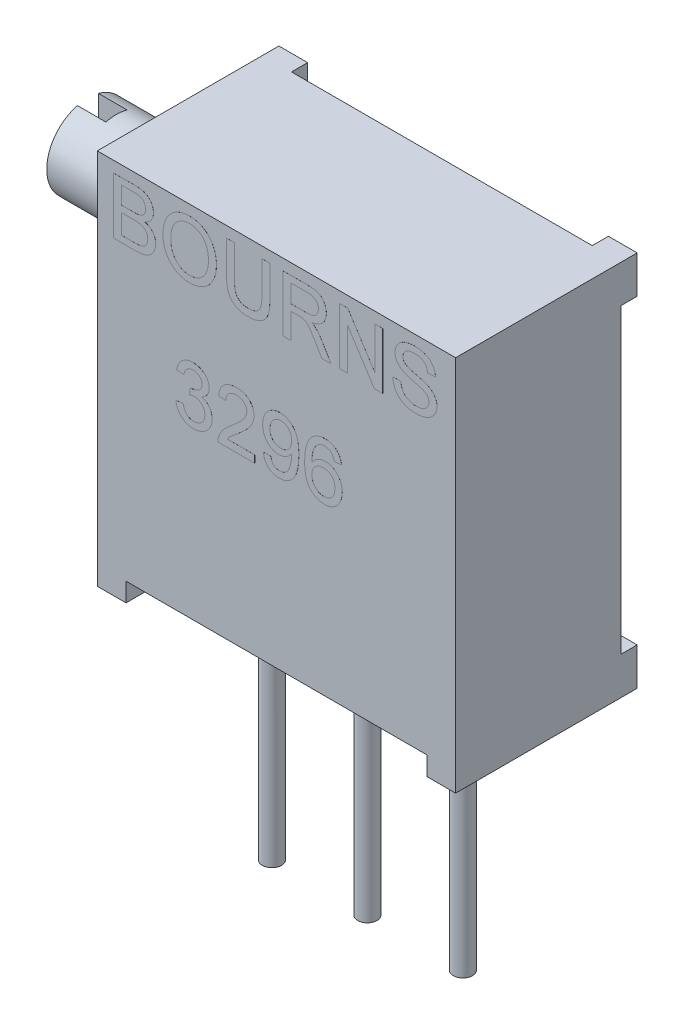
from build123d import *

# Parameters (mm, degrees)
SKETCH1_W          = 9.53
SKETCH1_H          = 10.03
EXTRUDE1_DEPTH     = 4.4
SKETCH2_W          = 8
SKETCH2_H          = 0.5
CUT_EXTRUDE1_DEPTH = 12.94429257
SKETCH3_W          = 0.765
SKETCH3_H          = 1
EXTRUDE2_DEPTH     = 0.43
SKETCH4_R          = 0.255
EXTRUDE3_DEPTH     = 6.9
EXTRUDE5_DEPTH     = 0.001
SKETCH_1_R         = 1.095
EXTRUDE8_DEPTH     = 1.52
SKETCH_2_W         = 0.56
SKETCH_2_H         = 4.322685763
CUT_EXTRUDE3_DEPTH = 0.76


with BuildPart() as part:
    # Sketch1 → Extrude1 (new body)
    with BuildSketch(Plane.XY):
        with Locations((0, 5.015)):
            Rectangle(SKETCH1_W, SKETCH1_H)
    extrude(amount=EXTRUDE1_DEPTH)

    # Sketch2 → Cut-Extrude1 (cut, through all)
    with BuildSketch(Plane.XY.offset(4.4)):
        with Locations((0, 0.25)):
            Rectangle(SKETCH2_W, SKETCH2_H)
    extrude(amount=-CUT_EXTRUDE1_DEPTH, mode=Mode.SUBTRACT)

    # Sketch3 → Extrude2 (add)
    with BuildSketch(Plane(origin=(0, 0, 0), x_dir=(-1, 0, 0), z_dir=(0, 0, -1))):
        with Locations((-4.3825, 0.5)):
            Rectangle(SKETCH3_W, SKETCH3_H)
        with Locations((4.3825, 0.5)):
            Rectangle(SKETCH3_W, SKETCH3_H)
        with Locations((4.3825, 9.53)):
            Rectangle(SKETCH3_W, SKETCH3_H)
        with Locations((-4.3825, 9.53)):
            Rectangle(SKETCH3_W, SKETCH3_H)
    extrude(amount=EXTRUDE2_DEPTH)

    # Sketch4 → Extrude3 (add)
    with BuildSketch(Plane.XZ.offset(-0.5)):
        with Locations(Location((2.54, 1.98, 0), (0, 0, 90))):
            Circle(SKETCH4_R)
        with Locations(Location((0, 1.98, 0), (0, 0, 90))):
            Circle(SKETCH4_R)
        with Locations(Location((-2.54, 1.98, 0), (0, 0, 90))):
            Circle(SKETCH4_R)
    extrude(amount=EXTRUDE3_DEPTH)

    # Sketch7 → Extrude5 (add)
    # profile 1 of 10: a face of its own
    with BuildSketch(Plane.XY.offset(4.4)):
        with BuildLine():
            Line((-4.326444342, 8.237150921), (-4.326444342, 9.737150921))
            Line((-4.326444342, 9.737150921), (-3.764845784, 9.737150921))
            add(Edge.make_bspline(
                [(-3.764845784, 9.737150921), (-3.750919069, 9.737097495), (-3.723744088, 9.736993245), (-3.684062996, 9.734386066), (-3.64648204, 9.730819986), (-3.610920315, 9.726223199), (-3.577531697, 9.719553354), (-3.5463473, 9.711473284), (-3.517204841, 9.702153183), (-3.481582627, 9.687955652), (-3.44053193, 9.666102632), (-3.396562734, 9.63349448), (-3.358307825, 9.594343785), (-3.326829661, 9.549455296), (-3.300895048, 9.501505925), (-3.282507712, 9.451409151), (-3.270751692, 9.400255705), (-3.269417834, 9.365618225), (-3.268752034, 9.348328806)],
                knots=[0, 0, 0, 0, 0.939712594, 1.833646414, 2.682508961, 3.487467313, 4.25240329, 4.978730417, 5.660668875, 6.315918528, 7.564895217, 8.787077865, 9.996481721, 11.241996224, 12.475862915, 13.665015424, 14.834484263, 16, 16, 16, 16], degree=3))
            add(Edge.make_bspline(
                [(-3.268752034, 9.348328806), (-3.26945193, 9.332243346), (-3.270844975, 9.300227505), (-3.281932051, 9.253066225), (-3.29943085, 9.207272915), (-3.324174647, 9.163404285), (-3.35580032, 9.122262901), (-3.395007125, 9.085240754), (-3.441231661, 9.052258501), (-3.475923175, 9.03467799), (-3.49381213, 9.025612459)],
                knots=[0, 0, 0, 0, 0.926741525, 1.844548388, 2.778836836, 3.746021974, 4.738420572, 5.759761325, 6.844803049, 8, 8, 8, 8], degree=3))
            add(Edge.make_bspline(
                [(-3.49381213, 9.025612459), (-3.482745904, 9.022148256), (-3.461080115, 9.015365935), (-3.429933293, 9.002955239), (-3.40069594, 8.988823885), (-3.373304413, 8.972948652), (-3.347943795, 8.955182527), (-3.324685642, 8.935497814), (-3.303368694, 8.914199128), (-3.284031035, 8.891299426), (-3.267044931, 8.866946071), (-3.251810517, 8.841671332), (-3.2392306, 8.815170846), (-3.228919301, 8.787513414), (-3.220874955, 8.758869935), (-3.215098238, 8.729130241), (-3.211805658, 8.698363557), (-3.211311122, 8.677463121), (-3.211059726, 8.666838421)],
                knots=[0, 0, 0, 0, 1.127427615, 2.20731145, 3.257257018, 4.283066884, 5.282973838, 6.264540225, 7.242620376, 8.210460609, 9.17525685, 10.12748095, 11.077310519, 12.023587065, 12.994999128, 13.967387486, 14.966724908, 16, 16, 16, 16], degree=3))
            add(Edge.make_bspline(
                [(-3.211059726, 8.666838421), (-3.211577892, 8.649780613), (-3.212604959, 8.615969962), (-3.220853456, 8.56620637), (-3.234792977, 8.518337989), (-3.253979542, 8.473138792), (-3.276841107, 8.43134548), (-3.302824076, 8.394052338), (-3.331265831, 8.36164311), (-3.362967261, 8.334381157), (-3.397723879, 8.311243736), (-3.436517359, 8.291760514), (-3.479047757, 8.27457818), (-3.526179479, 8.260852297), (-3.577891071, 8.249948474), (-3.634884306, 8.242864242), (-3.697246747, 8.237792882), (-3.74069542, 8.237370888), (-3.76334338, 8.237150921)],
                knots=[0, 0, 0, 0, 1.028073207, 2.037766189, 3.031549473, 4.027532207, 4.992436545, 5.898794514, 6.762903869, 7.584966804, 8.412380356, 9.273953678, 10.198004568, 11.174406109, 12.229717296, 13.381036288, 14.634844708, 16, 16, 16, 16], degree=3))
            Line((-3.76334338, 8.237150921), (-4.326444342, 8.237150921))
        make_face()
        with BuildLine():
            Line((-4.11490588, 9.102535536), (-3.805711169, 9.102535536))
            add(Edge.make_bspline(
                [(-3.805711169, 9.102535536), (-3.795593548, 9.102575565), (-3.776155313, 9.10265247), (-3.748116122, 9.103724756), (-3.722237293, 9.104639569), (-3.698618928, 9.106935678), (-3.677144021, 9.109184615), (-3.65789851, 9.112212035), (-3.640788132, 9.115623251), (-3.630311444, 9.11878741), (-3.625422707, 9.120263902)],
                knots=[0, 0, 0, 0, 1.335841395, 2.566453063, 3.705076039, 4.753984432, 5.69893722, 6.555639608, 7.326018133, 8, 8, 8, 8], degree=3))
            add(Edge.make_bspline(
                [(-3.625422707, 9.120263902), (-3.613935929, 9.124287721), (-3.591791825, 9.132044802), (-3.562116654, 9.149661914), (-3.536842034, 9.170802362), (-3.516035695, 9.195839435), (-3.500047055, 9.224639144), (-3.48819194, 9.256604254), (-3.481701001, 9.292181608), (-3.480773445, 9.316853252), (-3.480290496, 9.329698998)],
                knots=[0, 0, 0, 0, 1.059015028, 2.041559358, 2.989777133, 3.920090524, 4.862499371, 5.848878527, 6.879979022, 8, 8, 8, 8], degree=3))
            add(Edge.make_bspline(
                [(-3.480290496, 9.329698998), (-3.480678819, 9.342044591), (-3.481435618, 9.366104727), (-3.487788265, 9.401044217), (-3.498781285, 9.433548996), (-3.513668845, 9.463611935), (-3.532520451, 9.490357237), (-3.555020501, 9.513351936), (-3.581973973, 9.530734916), (-3.607167395, 9.541578455), (-3.629826882, 9.548362111), (-3.650072338, 9.552375722), (-3.673036723, 9.555912112), (-3.698795607, 9.558918633), (-3.727358734, 9.56125197), (-3.758814112, 9.563105652), (-3.793086864, 9.56389268), (-3.816828774, 9.564012054), (-3.829148669, 9.564073998)],
                knots=[0, 0, 0, 0, 1.216168307, 2.37017178, 3.484610845, 4.588286376, 5.664695412, 6.69777344, 7.738183022, 8.803673002, 9.390844981, 10.0665252, 10.835811589, 11.680682236, 12.621801058, 13.660007223, 14.785756265, 16, 16, 16, 16], degree=3))
            Line((-3.829148669, 9.564073998), (-4.11490588, 9.564073998))
            Line((-4.11490588, 9.564073998), (-4.11490588, 9.102535536))
        make_face(mode=Mode.SUBTRACT)
        with BuildLine():
            Line((-4.11490588, 8.410227844), (-3.760038092, 8.410227844))
            add(Edge.make_bspline(
                [(-3.760038092, 8.410227844), (-3.745915172, 8.410390096), (-3.719967473, 8.410688199), (-3.68447609, 8.41162336), (-3.655788079, 8.41390761), (-3.639035797, 8.416367164), (-3.631732803, 8.417439383)],
                knots=[0, 0, 0, 0, 1.317581857, 2.420761387, 3.311546315, 4, 4, 4, 4], degree=3))
            add(Edge.make_bspline(
                [(-3.631732803, 8.417439383), (-3.621262478, 8.419640139), (-3.60098922, 8.423901372), (-3.572408792, 8.433412), (-3.546204152, 8.444306931), (-3.522832664, 8.458153179), (-3.501191226, 8.47411003), (-3.482383206, 8.494040902), (-3.465060127, 8.516685746), (-3.450051204, 8.542600195), (-3.43791431, 8.571268479), (-3.42863829, 8.602247654), (-3.423697206, 8.635429101), (-3.422969697, 8.658209966), (-3.422598188, 8.669843229)],
                knots=[0, 0, 0, 0, 1.067651492, 2.067249321, 3.003744366, 3.895862395, 4.774133402, 5.679610569, 6.621910665, 7.616993802, 8.661192143, 9.724711987, 10.838102842, 12, 12, 12, 12], degree=3))
            add(Edge.make_bspline(
                [(-3.422598188, 8.669843229), (-3.42301209, 8.683501376), (-3.42381924, 8.710136157), (-3.431491485, 8.748624765), (-3.444164778, 8.784323428), (-3.462005081, 8.816737755), (-3.483887144, 8.845891651), (-3.51036223, 8.870622107), (-3.541232376, 8.890246947), (-3.576592458, 8.905648649), (-3.617921311, 8.916606694), (-3.666359943, 8.924041064), (-3.722683143, 8.928838285), (-3.762931606, 8.929242981), (-3.784377034, 8.929458613)],
                knots=[0, 0, 0, 0, 0.96167883, 1.875371887, 2.752872588, 3.621584364, 4.472914353, 5.312011319, 6.159851575, 7.038572308, 8.019870099, 9.164119506, 10.488969081, 12, 12, 12, 12], degree=3))
            Line((-3.784377034, 8.929458613), (-4.11490588, 8.929458613))
            Line((-4.11490588, 8.929458613), (-4.11490588, 8.410227844))
        make_face(mode=Mode.SUBTRACT)
    # profile 2 of 10: a face of its own
    with BuildSketch(Plane.XY.offset(4.4)):
        with BuildLine():
            add(Edge.make_bspline(
                [(-3.018752034, 8.96731919), (-3.018230692, 8.997392897), (-3.017214883, 9.055989991), (-3.007723632, 9.141314909), (-2.992312277, 9.221594495), (-2.970280381, 9.296822497), (-2.942354889, 9.367116795), (-2.90840612, 9.432636561), (-2.867412916, 9.492640158), (-2.821039156, 9.547698782), (-2.769241797, 9.596374641), (-2.714092331, 9.639605778), (-2.654902115, 9.675665657), (-2.592218021, 9.705439229), (-2.525773732, 9.728298516), (-2.455755803, 9.744302096), (-2.382239117, 9.754625961), (-2.331988742, 9.755787946), (-2.30631213, 9.75638169)],
                knots=[0, 0, 0, 0, 1.203621547, 2.345195544, 3.432004029, 4.472479546, 5.478447225, 6.455936844, 7.420185704, 8.381829745, 9.332027588, 10.260832629, 11.182364398, 12.100723901, 13.034044877, 13.989196293, 14.972532542, 16, 16, 16, 16], degree=3))
            add(Edge.make_bspline(
                [(-2.30631213, 9.75638169), (-2.289376641, 9.756085965), (-2.255745821, 9.755498707), (-2.206025657, 9.751030463), (-2.157583125, 9.74305542), (-2.110465931, 9.732367968), (-2.064545821, 9.718346497), (-2.019795371, 9.701794576), (-1.976606323, 9.681284416), (-1.934691352, 9.658321251), (-1.894545231, 9.632635958), (-1.856816008, 9.604261466), (-1.821594055, 9.573412372), (-1.788406246, 9.540595749), (-1.758360012, 9.504704083), (-1.730214065, 9.466830696), (-1.704777197, 9.426304031), (-1.681959152, 9.383456134), (-1.661557501, 9.338948785), (-1.644120351, 9.292597519), (-1.629147388, 9.24495835), (-1.616613755, 9.195749307), (-1.607620535, 9.144987212), (-1.600459136, 9.092890794), (-1.596689895, 9.039289785), (-1.596016226, 9.003081348), (-1.595675111, 8.984747075)],
                knots=[0, 0, 0, 0, 1.034375294, 2.054082248, 3.045783978, 4.031219655, 5.002789406, 5.976610191, 6.94273282, 7.920236376, 8.894345378, 9.851183672, 10.800797181, 11.752517031, 12.698794154, 13.65688337, 14.632873302, 15.61821402, 16.620222298, 17.621258913, 18.640965868, 19.669244166, 20.720417492, 21.788124603, 22.880008887, 24, 24, 24, 24], degree=3))
            add(Edge.make_bspline(
                [(-1.595675111, 8.984747075), (-1.595987646, 8.966110469), (-1.596605114, 8.929290641), (-1.600783152, 8.87489649), (-1.608129594, 8.822063882), (-1.617873399, 8.77063528), (-1.630929801, 8.720717747), (-1.646445328, 8.672168168), (-1.665212234, 8.625275712), (-1.686407371, 8.579927361), (-1.71038966, 8.536746809), (-1.736843752, 8.496035998), (-1.765788388, 8.458175743), (-1.796783902, 8.422701596), (-1.830554122, 8.390247902), (-1.866683213, 8.360511195), (-1.90503226, 8.333211022), (-1.945730096, 8.30908676), (-1.988046343, 8.287940982), (-2.031143628, 8.269180868), (-2.075053966, 8.253181495), (-2.119927428, 8.240215594), (-2.165641605, 8.230417626), (-2.21206785, 8.223080805), (-2.259358356, 8.218856237), (-2.291179863, 8.218233784), (-2.307213572, 8.217920152)],
                knots=[0, 0, 0, 0, 1.141429366, 2.255090526, 3.338676798, 4.407031443, 5.458968682, 6.496860253, 7.526652771, 8.550250826, 9.560787671, 10.54935636, 11.521089193, 12.477323897, 13.431786008, 14.386110112, 15.340986122, 16.312041, 17.28047646, 18.236612773, 19.189437236, 20.140779471, 21.09494583, 22.051062463, 23.018000708, 24, 24, 24, 24], degree=3))
            add(Edge.make_bspline(
                [(-2.307213572, 8.217920152), (-2.324453371, 8.218175217), (-2.358601094, 8.218680436), (-2.409072348, 8.223723391), (-2.458287957, 8.231416594), (-2.506104842, 8.242523255), (-2.552457663, 8.25701268), (-2.597401266, 8.27455022), (-2.641093722, 8.294901493), (-2.682992881, 8.318649222), (-2.722956135, 8.345054144), (-2.760596145, 8.373985002), (-2.795892098, 8.405175171), (-2.828277639, 8.439140188), (-2.858801633, 8.474648809), (-2.886243593, 8.513020865), (-2.911499732, 8.55338612), (-2.933822678, 8.596133677), (-2.95398812, 8.639993241), (-2.97097794, 8.68497884), (-2.985908699, 8.730427507), (-2.997799537, 8.776619369), (-3.007275088, 8.823447871), (-3.01364671, 8.870835093), (-3.018248343, 8.918851609), (-3.018583292, 8.951082028), (-3.018752034, 8.96731919)],
                knots=[0, 0, 0, 0, 1.072727997, 2.12480551, 3.153819198, 4.171534612, 5.177148798, 6.173931848, 7.17235114, 8.174500385, 9.168706755, 10.151274001, 11.127173509, 12.097141049, 13.070188938, 14.039134204, 15.03036519, 16.031505612, 17.038625933, 18.033164522, 19.022845559, 20.014762458, 21.000193215, 21.994692725, 22.989758729, 24, 24, 24, 24], degree=3))
        make_face()
        with BuildLine():
            add(Edge.make_bspline(
                [(-2.807213572, 8.964915344), (-2.8068894, 8.943259561), (-2.806257286, 8.901032314), (-2.799025562, 8.839467232), (-2.788052575, 8.781377442), (-2.772927471, 8.726599873), (-2.752595628, 8.675676265), (-2.728286277, 8.628117292), (-2.699180916, 8.584239101), (-2.665921697, 8.544164434), (-2.629340369, 8.508164356), (-2.590249507, 8.476720203), (-2.548640324, 8.450387949), (-2.504974133, 8.428645052), (-2.458937298, 8.411672739), (-2.410667702, 8.399755208), (-2.360129877, 8.39230176), (-2.325669313, 8.391437388), (-2.308115015, 8.390997075)],
                knots=[0, 0, 0, 0, 1.215430442, 2.370003584, 3.475209778, 4.53279855, 5.55522989, 6.548792651, 7.526809858, 8.505409025, 9.467826767, 10.404123909, 11.316848639, 12.227335424, 13.138360512, 14.065900994, 15.014765094, 16, 16, 16, 16], degree=3))
            add(Edge.make_bspline(
                [(-2.308115015, 8.390997075), (-2.290263171, 8.3914439), (-2.25530931, 8.392318784), (-2.204009559, 8.399642118), (-2.155269053, 8.412109783), (-2.108604686, 8.42870707), (-2.064860106, 8.451143772), (-2.02301225, 8.477417027), (-1.984201898, 8.509522192), (-1.947476365, 8.54558594), (-1.914536035, 8.586579013), (-1.885308427, 8.631491621), (-1.861565976, 8.680997339), (-1.841067574, 8.734005623), (-1.826057462, 8.791518352), (-1.81496407, 8.85288172), (-1.808278957, 8.918293114), (-1.80757498, 8.963196823), (-1.807213572, 8.986249479)],
                knots=[0, 0, 0, 0, 0.976878588, 1.912725521, 2.8289017, 3.727303729, 4.617335839, 5.514666588, 6.426584173, 7.368641557, 8.327632997, 9.299405846, 10.294892156, 11.327373912, 12.405931897, 13.542618837, 14.738430195, 16, 16, 16, 16], degree=3))
            add(Edge.make_bspline(
                [(-1.807213572, 8.986249479), (-1.807341294, 9.001080057), (-1.807591837, 9.030172285), (-1.810909864, 9.073054562), (-1.815189695, 9.114602954), (-1.821705802, 9.15476385), (-1.830685826, 9.193370934), (-1.840634167, 9.230718122), (-1.853074219, 9.266483577), (-1.867189192, 9.300807558), (-1.882983608, 9.333513851), (-1.900797609, 9.36432673), (-1.920424159, 9.3931264), (-1.941333711, 9.420458875), (-1.964684118, 9.445266276), (-1.989351045, 9.468596479), (-2.015894798, 9.489967476), (-2.044050482, 9.509384851), (-2.073418672, 9.526863548), (-2.103938825, 9.541823045), (-2.135124711, 9.554963084), (-2.167498339, 9.565035475), (-2.200612691, 9.573159006), (-2.234601633, 9.579329585), (-2.269591323, 9.582524997), (-2.293185557, 9.583042977), (-2.305110207, 9.583304767)],
                knots=[0, 0, 0, 0, 1.220438779, 2.394059227, 3.538503547, 4.658058814, 5.74010225, 6.800155734, 7.837851593, 8.854470756, 9.853724944, 10.825214244, 11.781044712, 12.72106398, 13.654479919, 14.581868691, 15.514082315, 16.456304431, 17.39516604, 18.324312202, 19.252140633, 20.177768678, 21.111585046, 22.057694709, 23.018348693, 24, 24, 24, 24], degree=3))
            add(Edge.make_bspline(
                [(-2.305110207, 9.583304767), (-2.321964073, 9.582970056), (-2.355218629, 9.582309634), (-2.404173295, 9.574968014), (-2.4513709, 9.56399863), (-2.496884691, 9.548662848), (-2.540325395, 9.528355862), (-2.581918075, 9.503452123), (-2.622031926, 9.47462972), (-2.660034411, 9.441186401), (-2.695461039, 9.402768193), (-2.725410699, 9.357474302), (-2.750653091, 9.30638599), (-2.771730023, 9.249632752), (-2.787800563, 9.186775074), (-2.798907316, 9.11808346), (-2.805919894, 9.043485528), (-2.806771322, 8.991774955), (-2.807213572, 8.964915344)],
                knots=[0, 0, 0, 0, 0.895090134, 1.766112571, 2.624765742, 3.468151641, 4.313618154, 5.168136083, 6.041303099, 6.935189387, 7.854749729, 8.809996334, 9.809869957, 10.877771942, 12.021723904, 13.25217762, 14.572720513, 16, 16, 16, 16], degree=3))
        make_face(mode=Mode.SUBTRACT)
    # profile 3 of 10: a face of its own
    with BuildSketch(Plane.XY.offset(4.4)):
        with BuildLine():
            Line((-0.384136649, 9.737150921), (-0.172598188, 9.737150921))
            Line((-0.172598188, 9.737150921), (-0.172598188, 8.874170152))
            add(Edge.make_bspline(
                [(-0.172598188, 8.874170152), (-0.172817713, 8.855839279), (-0.17324491, 8.820167371), (-0.175210197, 8.768143941), (-0.179038667, 8.719011196), (-0.184899968, 8.672848597), (-0.19152619, 8.629455925), (-0.200351288, 8.589070404), (-0.210472953, 8.551529041), (-0.222118871, 8.516578197), (-0.236215171, 8.483981753), (-0.252320236, 8.453041696), (-0.27110134, 8.423667691), (-0.292509773, 8.395904321), (-0.316659126, 8.369903341), (-0.342889972, 8.34499824), (-0.371894747, 8.32187367), (-0.403354379, 8.300264922), (-0.437307933, 8.280653275), (-0.473904053, 8.263733066), (-0.513098094, 8.24978275), (-0.554713075, 8.237914738), (-0.59895675, 8.229115881), (-0.645687182, 8.222441781), (-0.694966239, 8.218516166), (-0.728680904, 8.218121765), (-0.745915496, 8.217920152)],
                knots=[0, 0, 0, 0, 1.311435591, 2.552055809, 3.723716842, 4.835547674, 5.880436826, 6.862821995, 7.791032428, 8.661143393, 9.495683908, 10.328993084, 11.1538804, 11.986573222, 12.833449924, 13.690091648, 14.571895854, 15.484149563, 16.418232274, 17.373591634, 18.364096258, 19.391643703, 20.466661433, 21.588422397, 22.767226238, 24, 24, 24, 24], degree=3))
            add(Edge.make_bspline(
                [(-0.745915496, 8.217920152), (-0.762747176, 8.218167913), (-0.795542393, 8.218650658), (-0.843600901, 8.221914973), (-0.889315102, 8.227699697), (-0.932822961, 8.235291305), (-0.973978437, 8.245579942), (-1.01272043, 8.258173326), (-1.049181209, 8.272904412), (-1.083365134, 8.2896649), (-1.11487259, 8.309015777), (-1.144260591, 8.330138013), (-1.171397739, 8.353261603), (-1.19603194, 8.378594967), (-1.218455258, 8.405756623), (-1.238355176, 8.435036855), (-1.255779343, 8.466487887), (-1.271165901, 8.500026899), (-1.284571795, 8.536147585), (-1.295381776, 8.575342209), (-1.305161568, 8.617510171), (-1.312667758, 8.662804669), (-1.319261137, 8.711168829), (-1.323084681, 8.762745583), (-1.325997838, 8.817446196), (-1.326292931, 8.854934905), (-1.326444342, 8.874170152)],
                knots=[0, 0, 0, 0, 1.192889473, 2.324252067, 3.41162405, 4.457325556, 5.452435892, 6.415456921, 7.342133401, 8.237363544, 9.110250727, 9.959377435, 10.800155199, 11.633438097, 12.46053001, 13.293359256, 14.138649731, 15.005774073, 15.906391469, 16.865847877, 17.8852706, 18.972920589, 20.118424796, 21.343408205, 22.636917643, 24, 24, 24, 24], degree=3))
            Line((-1.326444342, 8.874170152), (-1.326444342, 9.737150921))
            Line((-1.326444342, 9.737150921), (-1.11490588, 9.737150921))
            Line((-1.11490588, 9.737150921), (-1.11490588, 8.884086017))
            add(Edge.make_bspline(
                [(-1.11490588, 8.884086017), (-1.114767658, 8.868560422), (-1.114500957, 8.838603557), (-1.113109482, 8.795207672), (-1.110326775, 8.754936554), (-1.106886612, 8.717728723), (-1.102157025, 8.683718544), (-1.09610028, 8.652955825), (-1.089306625, 8.625335805), (-1.079133218, 8.593035516), (-1.062246323, 8.556979041), (-1.035633784, 8.518762127), (-1.003161194, 8.485560874), (-0.964517851, 8.458141879), (-0.920633994, 8.436355447), (-0.871805449, 8.421333433), (-0.818611502, 8.411672805), (-0.781617528, 8.410721136), (-0.762441938, 8.410227844)],
                knots=[0, 0, 0, 0, 1.090245215, 2.103644224, 3.048223674, 3.924421557, 4.727106666, 5.45815927, 6.12513286, 6.723455763, 7.834131158, 8.905266051, 9.9795367, 11.078391299, 12.21701853, 13.404826756, 14.65480846, 16, 16, 16, 16], degree=3))
            add(Edge.make_bspline(
                [(-0.762441938, 8.410227844), (-0.746007063, 8.410507631), (-0.714272984, 8.411047872), (-0.668513344, 8.415404728), (-0.6265627, 8.423347367), (-0.588072882, 8.433582839), (-0.553314751, 8.447483141), (-0.522075787, 8.464324146), (-0.494465601, 8.484196483), (-0.470286071, 8.507638528), (-0.449452221, 8.535691341), (-0.431893065, 8.569123488), (-0.416934773, 8.607964106), (-0.404676645, 8.652341416), (-0.395738752, 8.702466188), (-0.388751711, 8.758015588), (-0.385088051, 8.819233831), (-0.384462913, 8.861846319), (-0.384136649, 8.884086017)],
                knots=[0, 0, 0, 0, 1.111629428, 2.146443922, 3.104513091, 3.997025448, 4.836178689, 5.630482806, 6.392099463, 7.129930272, 7.899580577, 8.745272349, 9.676297551, 10.710246713, 11.854352966, 13.117392195, 14.495550762, 16, 16, 16, 16], degree=3))
            Line((-0.384136649, 8.884086017), (-0.384136649, 9.737150921))
        make_face()
    # profile 4 of 10: a face of its own
    with BuildSketch(Plane.XY.offset(4.4)):
        with BuildLine():
            Line((0.173555658, 8.237150921), (0.173555658, 9.737150921))
            Line((0.173555658, 9.737150921), (0.824397004, 9.737150921))
            add(Edge.make_bspline(
                [(0.824397004, 9.737150921), (0.839722325, 9.737030841), (0.86938269, 9.73679844), (0.912396343, 9.735153303), (0.952545276, 9.731606819), (0.98990331, 9.727771792), (1.024463806, 9.721885537), (1.05619111, 9.715134136), (1.085134208, 9.707099866), (1.111422492, 9.697610774), (1.135812287, 9.686875288), (1.158419785, 9.673629431), (1.18018475, 9.659114797), (1.200299409, 9.642062268), (1.219294287, 9.623391327), (1.237151779, 9.602848275), (1.25360752, 9.580254841), (1.273903706, 9.547918952), (1.295677375, 9.504854357), (1.313818262, 9.449741006), (1.325515181, 9.39209043), (1.326766785, 9.352692939), (1.327401812, 9.332703806)],
                knots=[0, 0, 0, 0, 1.242255013, 2.404239178, 3.487702428, 4.508875116, 5.447164253, 6.327763259, 7.137389581, 7.87956647, 8.591787438, 9.293660819, 10.000726923, 10.709654955, 11.427269343, 12.158170644, 12.913245971, 13.690346794, 15.251572448, 16.809945773, 18.381459854, 20, 20, 20, 20], degree=3))
            add(Edge.make_bspline(
                [(1.327401812, 9.332703806), (1.327108288, 9.319872565), (1.326528558, 9.294529983), (1.322087769, 9.257269606), (1.314052519, 9.221668814), (1.303748895, 9.187415821), (1.289646376, 9.154995938), (1.273309221, 9.123746979), (1.253069809, 9.094527437), (1.230409548, 9.066559241), (1.204424306, 9.040441395), (1.17488549, 9.017116168), (1.142085913, 8.99613508), (1.105871101, 8.978077007), (1.066657924, 8.96157107), (1.023954363, 8.948279695), (0.977932767, 8.937426268), (0.946028457, 8.93217062), (0.929565274, 8.929458613)],
                knots=[0, 0, 0, 0, 0.982609109, 1.940720374, 2.867584677, 3.775009516, 4.675469332, 5.571146231, 6.471115823, 7.392408543, 8.32534739, 9.286126426, 10.269214477, 11.301811357, 12.381622301, 13.524260118, 14.722474812, 16, 16, 16, 16], degree=3))
            add(Edge.make_bspline(
                [(0.929565274, 8.929458613), (0.941641642, 8.923357898), (0.964575101, 8.911772421), (0.996326759, 8.893606493), (1.02324154, 8.875045391), (1.038834637, 8.861769945), (1.046151812, 8.855540344)],
                knots=[0, 0, 0, 0, 1.172304973, 2.226249348, 3.167654437, 4, 4, 4, 4], degree=3))
            add(Edge.make_bspline(
                [(1.046151812, 8.855540344), (1.060321936, 8.841649482), (1.089428377, 8.813116664), (1.129538316, 8.764516917), (1.16842628, 8.710417941), (1.192053651, 8.671320427), (1.204204697, 8.651213421)],
                knots=[0, 0, 0, 0, 0.918110279, 1.885863737, 2.912745394, 4, 4, 4, 4], degree=3))
            Line((1.204204697, 8.651213421), (1.450298447, 8.237150921))
            Line((1.450298447, 8.237150921), (1.207810466, 8.237150921))
            Line((1.207810466, 8.237150921), (1.020911428, 8.553857652))
            add(Edge.make_bspline(
                [(1.020911428, 8.553857652), (1.014191477, 8.564969688), (1.001169316, 8.58650299), (0.982359271, 8.617951341), (0.96391664, 8.646904558), (0.946811416, 8.674190141), (0.930349439, 8.699312734), (0.914689771, 8.722359607), (0.900263372, 8.743633105), (0.882394413, 8.768400992), (0.861597912, 8.79580689), (0.837329822, 8.82402979), (0.814219405, 8.846531531), (0.7857585, 8.868596883), (0.750505364, 8.88923531), (0.720539532, 8.898718101), (0.706007581, 8.903316786)],
                knots=[0, 0, 0, 0, 1.130940588, 2.191577161, 3.191089816, 4.120344442, 4.99615009, 5.80661983, 6.546979556, 7.234477901, 8.466216387, 9.541989141, 10.473533583, 11.269175393, 12.675684693, 14, 14, 14, 14], degree=3))
            add(Edge.make_bspline(
                [(0.706007581, 8.903316786), (0.699910513, 8.904416295), (0.685990724, 8.906926506), (0.662354957, 8.908565929), (0.633717326, 8.910305957), (0.612963146, 8.910255258), (0.601740754, 8.910227844)],
                knots=[0, 0, 0, 0, 0.709978628, 1.620902492, 2.713552433, 4, 4, 4, 4], degree=3))
            Line((0.601740754, 8.910227844), (0.38509412, 8.910227844))
            Line((0.38509412, 8.910227844), (0.38509412, 8.237150921))
            Line((0.38509412, 8.237150921), (0.173555658, 8.237150921))
        make_face()
        with BuildLine():
            Line((0.38509412, 9.083304767), (0.786836908, 9.083304767))
            add(Edge.make_bspline(
                [(0.786836908, 9.083304767), (0.806981813, 9.083619953), (0.844640824, 9.084209164), (0.897300993, 9.089240406), (0.942179174, 9.097235264), (0.980162544, 9.108896699), (1.012074571, 9.125086645), (1.039829066, 9.144817119), (1.062893402, 9.169531591), (1.082080546, 9.197416611), (1.096995107, 9.228102684), (1.10775376, 9.260333904), (1.114795486, 9.29383939), (1.115504243, 9.31664276), (1.115863351, 9.328196594)],
                knots=[0, 0, 0, 0, 1.546323217, 2.890706218, 4.056530419, 5.041445823, 5.928701482, 6.793137403, 7.641659452, 8.509781392, 9.383301667, 10.251423607, 11.114044887, 12, 12, 12, 12], degree=3))
            add(Edge.make_bspline(
                [(1.115863351, 9.328196594), (1.115584159, 9.336616312), (1.115037306, 9.353108067), (1.11217052, 9.377313385), (1.106596807, 9.400314031), (1.099236732, 9.422231591), (1.089402179, 9.442905533), (1.07771913, 9.462496058), (1.063777647, 9.480894587), (1.047808481, 9.498157164), (1.029472975, 9.513864423), (1.008529518, 9.52741638), (0.985143287, 9.538932621), (0.959287102, 9.548072679), (0.931042413, 9.555383237), (0.90024843, 9.560246716), (0.86704598, 9.563765913), (0.844038607, 9.563969384), (0.832209504, 9.564073998)],
                knots=[0, 0, 0, 0, 0.965208469, 1.890559848, 2.786986821, 3.67262109, 4.535197034, 5.405224191, 6.282113641, 7.175449223, 8.095446547, 9.040936516, 10.026471658, 11.075712529, 12.17809725, 13.364958037, 14.645208957, 16, 16, 16, 16], degree=3))
            Line((0.832209504, 9.564073998), (0.38509412, 9.564073998))
            Line((0.38509412, 9.564073998), (0.38509412, 9.083304767))
        make_face(mode=Mode.SUBTRACT)
    # profile 5 of 10: a face of its own
    with BuildSketch(Plane.XY.offset(4.4)):
        Polygon((1.673555658, 8.237150921), (1.673555658, 9.737150921), (1.897113351, 9.737150921), (2.615863351, 8.617860056), (2.615863351, 9.737150921), (2.827401812, 9.737150921), (2.827401812, 8.237150921), (2.60384412, 8.237150921), (1.88509412, 9.356441786), (1.88509412, 8.237150921), align=None)
    # profile 6 of 10: a face of its own
    with BuildSketch(Plane.XY.offset(4.4)):
        with BuildLine():
            Line((3.096632581, 8.75638169), (3.308171043, 8.75638169))
            add(Edge.make_bspline(
                [(3.308171043, 8.75638169), (3.310497843, 8.737388445), (3.314967752, 8.700901399), (3.327466063, 8.649186503), (3.343552197, 8.602689505), (3.363595075, 8.560793306), (3.389960718, 8.52400024), (3.421726783, 8.490813457), (3.460304939, 8.462075712), (3.503850884, 8.436501001), (3.552348913, 8.416420809), (3.604124885, 8.401535032), (3.658931873, 8.39271509), (3.696460325, 8.391577796), (3.715622966, 8.390997075)],
                knots=[0, 0, 0, 0, 1.125557648, 2.162256852, 3.1243583, 4.018160113, 4.88511607, 5.777380551, 6.711250965, 7.707237736, 8.743031335, 9.791730543, 10.872421559, 12, 12, 12, 12], degree=3))
            add(Edge.make_bspline(
                [(3.715622966, 8.390997075), (3.732580253, 8.391310936), (3.765643678, 8.391922905), (3.813473618, 8.399274166), (3.858481731, 8.409701733), (3.899830369, 8.42547506), (3.937367, 8.444628825), (3.969963359, 8.467795753), (3.997792396, 8.493921683), (4.019584549, 8.523694759), (4.03670403, 8.554891964), (4.049262938, 8.586959473), (4.056744023, 8.619719296), (4.057697308, 8.641761795), (4.058171043, 8.652715825)],
                knots=[0, 0, 0, 0, 1.267006637, 2.470417599, 3.611360613, 4.716023143, 5.771382139, 6.754486395, 7.697536124, 8.612899418, 9.501261124, 10.352596716, 11.181322154, 12, 12, 12, 12], degree=3))
            add(Edge.make_bspline(
                [(4.058171043, 8.652715825), (4.057664611, 8.663558897), (4.056674791, 8.684751666), (4.050224406, 8.71560569), (4.037964538, 8.743846084), (4.022055951, 8.770625489), (3.99992439, 8.795109454), (3.97196366, 8.817669243), (3.937557717, 8.838122166), (3.911878856, 8.849323379), (3.898315274, 8.855239863)],
                knots=[0, 0, 0, 0, 0.942140154, 1.841411588, 2.718743672, 3.605002079, 4.535543111, 5.568170452, 6.715506882, 8, 8, 8, 8], degree=3))
            add(Edge.make_bspline(
                [(3.898315274, 8.855239863), (3.893030701, 8.857408477), (3.881091893, 8.86230777), (3.860629335, 8.868793591), (3.836347919, 8.877180419), (3.807664303, 8.885817486), (3.774732043, 8.894954296), (3.737605968, 8.905295779), (3.696306823, 8.91629338), (3.652005924, 8.927999128), (3.607275516, 8.93990208), (3.564540836, 8.951816178), (3.5252229, 8.963910513), (3.488999639, 8.975555689), (3.456057801, 8.987248909), (3.42630389, 8.998670037), (3.39970081, 9.009587356), (3.383452661, 9.017614692), (3.375779216, 9.021405729)],
                knots=[0, 0, 0, 0, 0.499201778, 1.127787504, 1.87543728, 2.745208432, 3.745951656, 4.863402235, 6.114490242, 7.482339553, 8.869366102, 10.161191451, 11.360587006, 12.46547846, 13.487450326, 14.41601931, 15.251940103, 16, 16, 16, 16], degree=3))
            add(Edge.make_bspline(
                [(3.375779216, 9.021405729), (3.35812476, 9.030943175), (3.324047064, 9.049352927), (3.278182261, 9.082269616), (3.239536508, 9.118796776), (3.208272844, 9.158881439), (3.183772734, 9.201845678), (3.167242617, 9.247762533), (3.155920851, 9.295798527), (3.154862803, 9.328830804), (3.154324889, 9.345624479)],
                knots=[0, 0, 0, 0, 1.158441928, 2.236094408, 3.251151369, 4.220012324, 5.163146324, 6.095083285, 7.031536583, 8, 8, 8, 8], degree=3))
            add(Edge.make_bspline(
                [(3.154324889, 9.345624479), (3.155038808, 9.364220637), (3.156458787, 9.40120826), (3.169054782, 9.455485292), (3.189145635, 9.507714234), (3.212015126, 9.549179557), (3.234317935, 9.580535449), (3.252807132, 9.603117389), (3.273546383, 9.623991357), (3.295896991, 9.643448738), (3.320258496, 9.661198819), (3.346026486, 9.677971103), (3.374133618, 9.692387284), (3.413628319, 9.710735829), (3.466462713, 9.729058566), (3.532974606, 9.745024508), (3.60297619, 9.754426519), (3.650690914, 9.755720748), (3.675058062, 9.75638169)],
                knots=[0, 0, 0, 0, 1.199927478, 2.386647047, 3.578628709, 4.806592355, 5.433127754, 6.062729195, 6.689531802, 7.331674828, 7.974827539, 8.635320743, 9.315455226, 10.01318112, 11.447700238, 12.918145351, 14.426146008, 16, 16, 16, 16], degree=3))
            add(Edge.make_bspline(
                [(3.675058062, 9.75638169), (3.701729524, 9.755770554), (3.753664, 9.754580555), (3.829126262, 9.744679979), (3.899511893, 9.727678083), (3.954710721, 9.708646167), (3.995518568, 9.689378935), (4.024509599, 9.674344909), (4.051419009, 9.656962836), (4.076489036, 9.638152714), (4.099952547, 9.617923133), (4.121206478, 9.595792899), (4.141173733, 9.572517055), (4.16463804, 9.539100235), (4.189937537, 9.494873263), (4.211812397, 9.437575464), (4.22684068, 9.377102341), (4.229764027, 9.335295723), (4.231247966, 9.314073998)],
                knots=[0, 0, 0, 0, 1.607600973, 3.130308851, 4.577334065, 5.967726088, 6.640410691, 7.296826776, 7.935019992, 8.569057421, 9.185393759, 9.8003086, 10.417295362, 11.032210203, 12.259799365, 13.477607022, 14.719591916, 16, 16, 16, 16], degree=3))
            Line((4.231247966, 9.314073998), (4.019709504, 9.314073998))
            add(Edge.make_bspline(
                [(4.019709504, 9.314073998), (4.01836542, 9.324814934), (4.015735446, 9.345831762), (4.009210828, 9.376256782), (4.000064628, 9.404514172), (3.989351623, 9.43086745), (3.97636522, 9.455042515), (3.96122683, 9.477271498), (3.943752103, 9.497292505), (3.924390679, 9.515634568), (3.902553396, 9.531605384), (3.878352458, 9.545468544), (3.851747016, 9.557179739), (3.822760508, 9.566771589), (3.791387195, 9.574208735), (3.757555718, 9.579679641), (3.721279153, 9.582481538), (3.696296049, 9.583025524), (3.683471524, 9.583304767)],
                knots=[0, 0, 0, 0, 1.074487479, 2.102453544, 3.083708351, 4.020042547, 4.923259678, 5.803182661, 6.684453325, 7.556870173, 8.445961597, 9.363679789, 10.320905216, 11.327237703, 12.390948353, 13.519046902, 14.726457512, 16, 16, 16, 16], degree=3))
            add(Edge.make_bspline(
                [(3.683471524, 9.583304767), (3.670141028, 9.583204288), (3.644336467, 9.583009786), (3.607033047, 9.579464247), (3.572457599, 9.574599641), (3.54066951, 9.567423935), (3.511772912, 9.558030911), (3.48533894, 9.547184123), (3.462107376, 9.533438411), (3.441536651, 9.518127475), (3.423791796, 9.50118677), (3.40849836, 9.483335363), (3.394972496, 9.465097741), (3.384462602, 9.445477024), (3.375905969, 9.425216278), (3.370386, 9.403934666), (3.366477733, 9.382025845), (3.366070975, 9.367077017), (3.365863351, 9.359446594)],
                knots=[0, 0, 0, 0, 1.464176581, 2.834285765, 4.113735764, 5.29917439, 6.409476712, 7.449999357, 8.431575861, 9.367089851, 10.262376129, 11.120706676, 11.948504824, 12.751342953, 13.560717798, 14.359016663, 15.162382702, 16, 16, 16, 16], degree=3))
            add(Edge.make_bspline(
                [(3.365863351, 9.359446594), (3.366410016, 9.346541253), (3.367471042, 9.321493177), (3.378305676, 9.285907411), (3.394969419, 9.25346868), (3.411385861, 9.235818932), (3.419649408, 9.226934575)],
                knots=[0, 0, 0, 0, 1.050964922, 2.039826012, 3.013306874, 4, 4, 4, 4], degree=3))
            add(Edge.make_bspline(
                [(3.419649408, 9.226934575), (3.42485866, 9.222494598), (3.4363786, 9.212675865), (3.457813222, 9.19968192), (3.484388976, 9.186553195), (3.516283435, 9.173502227), (3.553441723, 9.160370577), (3.595803905, 9.146849929), (3.643531332, 9.133421398), (3.695169512, 9.120480787), (3.747336115, 9.107488153), (3.796911925, 9.094545037), (3.842430911, 9.082278526), (3.883820853, 9.070314553), (3.921124591, 9.058686949), (3.954212481, 9.0471521), (3.983352215, 9.036542966), (4.001203746, 9.029078573), (4.009493158, 9.025612459)],
                knots=[0, 0, 0, 0, 0.523891492, 1.158553688, 1.913783773, 2.794766643, 3.797521443, 4.933638669, 6.202080764, 7.596537849, 9.013317056, 10.322179469, 11.523240428, 12.626146501, 13.623953177, 14.517289671, 15.311498917, 16, 16, 16, 16], degree=3))
            add(Edge.make_bspline(
                [(4.009493158, 9.025612459), (4.020278105, 9.020639906), (4.041447148, 9.010879618), (4.071435932, 8.994215394), (4.099418721, 8.976910495), (4.125169432, 8.958499014), (4.148604802, 8.938942223), (4.169986865, 8.9184642), (4.189444761, 8.897180034), (4.206193367, 8.874408509), (4.221231896, 8.851070152), (4.23439161, 8.82683878), (4.244987559, 8.801571892), (4.254280868, 8.775574057), (4.260965422, 8.748556105), (4.266207461, 8.720790933), (4.269265054, 8.692148039), (4.269560074, 8.672754984), (4.269709504, 8.662932171)],
                knots=[0, 0, 0, 0, 1.198900896, 2.353241543, 3.461831299, 4.520043694, 5.547003373, 6.541368882, 7.508191797, 8.454912692, 9.392021408, 10.310662301, 11.235020644, 12.156274873, 13.095836685, 14.042125239, 15.00831306, 16, 16, 16, 16], degree=3))
            add(Edge.make_bspline(
                [(4.269709504, 8.662932171), (4.268926683, 8.643328505), (4.267372522, 8.604408712), (4.253990635, 8.547039138), (4.232968398, 8.491448341), (4.208314618, 8.447333981), (4.185009344, 8.413637021), (4.165431815, 8.389417187), (4.143721461, 8.367022259), (4.120412768, 8.345750647), (4.095324767, 8.326036362), (4.068245951, 8.30787269), (4.039462123, 8.29107055), (3.99835954, 8.270596158), (3.943768482, 8.249178), (3.874230433, 8.231341683), (3.800945752, 8.219770823), (3.750623966, 8.218545567), (3.72493787, 8.217920152)],
                knots=[0, 0, 0, 0, 1.197055466, 2.376552968, 3.581957237, 4.820753935, 5.454298064, 6.085440993, 6.72202542, 7.359198513, 8.013298489, 8.67051481, 9.351020706, 10.049282741, 11.476266879, 12.925760103, 14.430794493, 16, 16, 16, 16], degree=3))
            add(Edge.make_bspline(
                [(3.72493787, 8.217920152), (3.708606116, 8.218054929), (3.676614545, 8.218318938), (3.629606503, 8.221516171), (3.584557837, 8.226141125), (3.541512757, 8.233030046), (3.500606247, 8.242067936), (3.461691471, 8.252920696), (3.424676191, 8.265419886), (3.389689739, 8.280118717), (3.356823444, 8.297197153), (3.325486338, 8.315620464), (3.296190645, 8.336504151), (3.268874695, 8.359520058), (3.24284636, 8.384003276), (3.219184437, 8.410953679), (3.19708448, 8.439583141), (3.177051469, 8.47015369), (3.159155022, 8.502265362), (3.143061018, 8.535378874), (3.129501595, 8.569734442), (3.11857399, 8.605158431), (3.109317755, 8.641413784), (3.10289877, 8.678802989), (3.098179316, 8.717208657), (3.097151205, 8.743246885), (3.096632581, 8.75638169)],
                knots=[0, 0, 0, 0, 1.259822038, 2.467811403, 3.633536148, 4.752793854, 5.829021491, 6.863980041, 7.868367876, 8.841470325, 9.788447787, 10.724101269, 11.643985084, 12.560193707, 13.478453146, 14.398077254, 15.323914234, 16.266973849, 17.21495974, 18.158525798, 19.105629373, 20.061269543, 21.017128399, 21.990322895, 22.986232211, 24, 24, 24, 24], degree=3))
        make_face()
    # profile 7 of 10: a face of its own
    with BuildSketch(Plane.XY.offset(4.4)):
        with BuildLine():
            Line((-2.672598188, 5.333304767), (-2.480290496, 5.352535536))
            add(Edge.make_bspline(
                [(-2.480290496, 5.352535536), (-2.477726804, 5.340980551), (-2.47276625, 5.318622512), (-2.463221539, 5.286592299), (-2.453140228, 5.256861098), (-2.440642486, 5.230093926), (-2.428447406, 5.205196116), (-2.414116341, 5.183196423), (-2.398803319, 5.163520844), (-2.382225254, 5.14624244), (-2.364191115, 5.131363625), (-2.344941335, 5.118343859), (-2.324068801, 5.107470601), (-2.301733316, 5.09886163), (-2.278123, 5.091892596), (-2.253109542, 5.08677536), (-2.226560675, 5.083726959), (-2.208363582, 5.083447794), (-2.199040496, 5.083304767)],
                knots=[0, 0, 0, 0, 1.321063709, 2.556160278, 3.730472002, 4.821700466, 5.852032229, 6.822994757, 7.746964065, 8.632786469, 9.490489437, 10.352773447, 11.223141997, 12.11199479, 13.021433979, 13.96892724, 14.959401504, 16, 16, 16, 16], degree=3))
            add(Edge.make_bspline(
                [(-2.199040496, 5.083304767), (-2.188104846, 5.083460683), (-2.166747503, 5.083765187), (-2.135626332, 5.08833391), (-2.106009049, 5.094607201), (-2.078318216, 5.104444082), (-2.052168252, 5.116466568), (-2.027708134, 5.13132381), (-2.004770436, 5.148769931), (-1.983807586, 5.1689236), (-1.965060561, 5.191093278), (-1.948363702, 5.214510116), (-1.934557642, 5.239373924), (-1.922921213, 5.265334486), (-1.914332006, 5.292811314), (-1.908044014, 5.321461784), (-1.903934778, 5.351415467), (-1.903559134, 5.371852703), (-1.903367419, 5.382283133)],
                knots=[0, 0, 0, 0, 1.111377895, 2.170522867, 3.193923215, 4.186422864, 5.152846954, 6.117443035, 7.091571248, 8.078879332, 9.069127402, 10.041602243, 10.999610288, 11.957618333, 12.930786866, 13.922135183, 14.939532534, 16, 16, 16, 16], degree=3))
            add(Edge.make_bspline(
                [(-1.903367419, 5.382283133), (-1.90359274, 5.392209279), (-1.904033565, 5.411628995), (-1.907657496, 5.44013297), (-1.913981176, 5.46719093), (-1.922747309, 5.492959471), (-1.933948627, 5.517400761), (-1.947412282, 5.540716907), (-1.963879435, 5.562396935), (-1.982414668, 5.582673707), (-2.002631199, 5.601354431), (-2.024755088, 5.617244792), (-2.048037734, 5.630958692), (-2.072756612, 5.642032129), (-2.09880909, 5.65082118), (-2.126170331, 5.657138043), (-2.154971882, 5.660763547), (-2.174591141, 5.661204448), (-2.184617419, 5.661429767)],
                knots=[0, 0, 0, 0, 1.072815875, 2.098878726, 3.09954706, 4.07199174, 5.036203424, 6.001873089, 6.97636515, 7.972747947, 8.969130744, 9.945905975, 10.911575641, 11.885646534, 12.868345115, 13.879560892, 14.916365174, 16, 16, 16, 16], degree=3))
            add(Edge.make_bspline(
                [(-2.184617419, 5.661429767), (-2.193444947, 5.661195898), (-2.212179022, 5.660699573), (-2.24174766, 5.656317215), (-2.274499935, 5.650180885), (-2.297132692, 5.644158988), (-2.309016457, 5.640997075)],
                knots=[0, 0, 0, 0, 0.837610211, 1.777604146, 2.833088267, 4, 4, 4, 4], degree=3))
            Line((-2.309016457, 5.640997075), (-2.289184726, 5.814073998))
            add(Edge.make_bspline(
                [(-2.289184726, 5.814073998), (-2.283981344, 5.81350541), (-2.274788758, 5.812500912), (-2.265549816, 5.812131111), (-2.261540496, 5.811970633)],
                knots=[0, 0, 0, 0, 1.132082448, 2, 2, 2, 2], degree=3))
            add(Edge.make_bspline(
                [(-2.261540496, 5.811970633), (-2.243854556, 5.812645875), (-2.209160302, 5.813970488), (-2.158582806, 5.824976915), (-2.110650173, 5.842306178), (-2.073619118, 5.862982503), (-2.046158139, 5.88242971), (-2.028841798, 5.899964126), (-2.013230223, 5.918571684), (-2.001582712, 5.939915226), (-1.991519981, 5.962593255), (-1.985288658, 5.987499118), (-1.980744267, 6.01402742), (-1.980444469, 6.032401642), (-1.980290496, 6.041838421)],
                knots=[0, 0, 0, 0, 1.557468908, 3.055264441, 4.54122591, 6.035034992, 6.780215604, 7.498173296, 8.201377046, 8.913174237, 9.633083494, 10.382644491, 11.169345745, 12, 12, 12, 12], degree=3))
            add(Edge.make_bspline(
                [(-1.980290496, 6.041838421), (-1.980432601, 6.049460825), (-1.98071052, 6.064368098), (-1.983806661, 6.086223733), (-1.988927297, 6.106932621), (-1.995848347, 6.126715875), (-2.004919069, 6.145469814), (-2.016167477, 6.16317148), (-2.029019165, 6.180179965), (-2.044190128, 6.195616382), (-2.060436913, 6.210108884), (-2.078351973, 6.222314544), (-2.097082686, 6.233157478), (-2.117289642, 6.241350978), (-2.138473977, 6.24808737), (-2.16081678, 6.252807961), (-2.184326204, 6.255978154), (-2.200431849, 6.256245285), (-2.20865588, 6.25638169)],
                knots=[0, 0, 0, 0, 1.041493611, 2.036867705, 3.009952345, 3.954088258, 4.897230656, 5.850851638, 6.817653571, 7.805463921, 8.805067469, 9.788883576, 10.763797054, 11.758134544, 12.762883247, 13.799594994, 14.876406454, 16, 16, 16, 16], degree=3))
            add(Edge.make_bspline(
                [(-2.20865588, 6.25638169), (-2.224750101, 6.25575415), (-2.255830428, 6.254542277), (-2.300328621, 6.243329936), (-2.340652019, 6.22518691), (-2.370505519, 6.203910205), (-2.391704128, 6.183568472), (-2.406183902, 6.166326507), (-2.419135238, 6.14728635), (-2.430594845, 6.126454787), (-2.440407899, 6.103748041), (-2.449254094, 6.079447415), (-2.45610187, 6.053163856), (-2.459379093, 6.03495194), (-2.461059726, 6.025612459)],
                knots=[0, 0, 0, 0, 1.533565899, 2.961543033, 4.347411787, 5.731829577, 6.434842101, 7.147085226, 7.87612511, 8.629021686, 9.412189982, 10.234506416, 11.094615066, 12, 12, 12, 12], degree=3))
            Line((-2.461059726, 6.025612459), (-2.653367419, 6.044843229))
            add(Edge.make_bspline(
                [(-2.653367419, 6.044843229), (-2.650359152, 6.059712669), (-2.644458201, 6.088880246), (-2.632436042, 6.131006175), (-2.617775167, 6.170550427), (-2.600172323, 6.207331698), (-2.580459125, 6.241790174), (-2.557718521, 6.273517124), (-2.532483664, 6.302701169), (-2.504709731, 6.329253292), (-2.47477377, 6.352967309), (-2.442826559, 6.373423759), (-2.409130278, 6.390763549), (-2.373653378, 6.404742488), (-2.336423948, 6.416109483), (-2.297336073, 6.423640145), (-2.256566677, 6.428734259), (-2.22880438, 6.429214191), (-2.214665496, 6.429458613)],
                knots=[0, 0, 0, 0, 1.136581168, 2.229493434, 3.279335563, 4.293305329, 5.282068175, 6.250623624, 7.213783178, 8.169396253, 9.125981663, 10.071280146, 11.007896369, 11.961295906, 12.925420184, 13.920544621, 14.940967302, 16, 16, 16, 16], degree=3))
            add(Edge.make_bspline(
                [(-2.214665496, 6.429458613), (-2.195093913, 6.428823955), (-2.156609855, 6.427576012), (-2.100085741, 6.417664695), (-2.046020723, 6.401400026), (-1.99484986, 6.378854296), (-1.947453519, 6.351304007), (-1.905511663, 6.318286665), (-1.869584999, 6.280373461), (-1.840371323, 6.237978896), (-1.81723819, 6.192841353), (-1.800120366, 6.145986627), (-1.78989221, 6.097468653), (-1.788620567, 6.064621997), (-1.787982803, 6.048148517)],
                knots=[0, 0, 0, 0, 1.104647871, 2.172094857, 3.229560912, 4.285649672, 5.322588163, 6.317201348, 7.289435229, 8.260615662, 9.214246199, 10.146367077, 11.070353327, 12, 12, 12, 12], degree=3))
            add(Edge.make_bspline(
                [(-1.787982803, 6.048148517), (-1.788629368, 6.032576187), (-1.789905978, 6.001829368), (-1.799734371, 5.956872071), (-1.816342401, 5.914280088), (-1.83879022, 5.873903983), (-1.867899534, 5.83661692), (-1.903590389, 5.803390749), (-1.945291823, 5.773907545), (-1.976543521, 5.758561863), (-1.992610207, 5.750672556)],
                knots=[0, 0, 0, 0, 0.975609618, 1.926294443, 2.868398979, 3.832526731, 4.812148358, 5.820404151, 6.879456693, 8, 8, 8, 8], degree=3))
            add(Edge.make_bspline(
                [(-1.992610207, 5.750672556), (-1.981838566, 5.747952929), (-1.960740066, 5.742625976), (-1.930437835, 5.731588677), (-1.901950336, 5.718666778), (-1.874898419, 5.704031206), (-1.850067451, 5.68672227), (-1.826601532, 5.667796911), (-1.805387727, 5.64634367), (-1.785811434, 5.623127179), (-1.767999411, 5.598390402), (-1.753010419, 5.571652154), (-1.740075355, 5.543615335), (-1.729045562, 5.514076596), (-1.721119577, 5.482808171), (-1.715452248, 5.450052296), (-1.711712273, 5.415922777), (-1.711279374, 5.392609557), (-1.711059726, 5.380780729)],
                knots=[0, 0, 0, 0, 1.053251915, 2.063013066, 3.05373318, 4.018979697, 4.975584284, 5.920798056, 6.874756953, 7.832116109, 8.799604348, 9.761196922, 10.734637845, 11.72654167, 12.747371341, 13.789206138, 14.878271633, 16, 16, 16, 16], degree=3))
            add(Edge.make_bspline(
                [(-1.711059726, 5.380780729), (-1.711425738, 5.364631533), (-1.712145069, 5.332893182), (-1.718964348, 5.286268821), (-1.73010858, 5.241596415), (-1.745530703, 5.198724265), (-1.765072972, 5.157477403), (-1.789595297, 5.11843789), (-1.818370892, 5.08128839), (-1.85094989, 5.046384595), (-1.8866433, 5.014306932), (-1.925404978, 4.986530744), (-1.966468027, 4.962942767), (-2.00989927, 4.943706888), (-2.055583572, 4.928594139), (-2.10356638, 4.917760838), (-2.153996175, 4.911393995), (-2.188405181, 4.910621677), (-2.205951553, 4.910227844)],
                knots=[0, 0, 0, 0, 1.016055063, 1.996874249, 2.958724482, 3.910019225, 4.860394196, 5.826121543, 6.806008102, 7.814207964, 8.82789325, 9.821757317, 10.810247154, 11.803791187, 12.806673825, 13.834534493, 14.895752369, 16, 16, 16, 16], degree=3))
            add(Edge.make_bspline(
                [(-2.205951553, 4.910227844), (-2.221697966, 4.910524443), (-2.252697303, 4.911108344), (-2.298073931, 4.917191604), (-2.341547099, 4.925824448), (-2.382773046, 4.939133015), (-2.422230649, 4.955362596), (-2.459251637, 4.976125898), (-2.494501678, 4.999961364), (-2.527318995, 5.027549979), (-2.557521337, 5.058000599), (-2.584465438, 5.090862833), (-2.607602521, 5.126063716), (-2.628002396, 5.163076576), (-2.64449077, 5.202599125), (-2.65732958, 5.244292036), (-2.667119345, 5.288000573), (-2.670752036, 5.318039058), (-2.672598188, 5.333304767)],
                knots=[0, 0, 0, 0, 1.08471039, 2.135426191, 3.150939737, 4.135689946, 5.116584603, 6.086901885, 7.055842759, 8.045878862, 9.036901429, 10.008421467, 10.96965771, 11.936653536, 12.917548193, 13.915472582, 14.940632654, 16, 16, 16, 16], degree=3))
        make_face()
    # profile 8 of 10: a face of its own
    with BuildSketch(Plane.XY.offset(4.4)):
        with BuildLine():
            Line((-0.576444342, 5.121766306), (-0.576444342, 4.929458613))
            Line((-0.576444342, 4.929458613), (-1.557213572, 4.929458613))
            add(Edge.make_bspline(
                [(-1.557213572, 4.929458613), (-1.557233651, 4.940888), (-1.557273742, 4.963708465), (-1.553412152, 4.997458485), (-1.547364128, 5.030760782), (-1.54052563, 5.052116221), (-1.537081361, 5.062872075)],
                knots=[0, 0, 0, 0, 1.01057331, 2.01775941, 3.001627217, 4, 4, 4, 4], degree=3))
            add(Edge.make_bspline(
                [(-1.537081361, 5.062872075), (-1.530717497, 5.080445856), (-1.517759623, 5.116228969), (-1.491506833, 5.167859003), (-1.460627349, 5.21917679), (-1.430561824, 5.260956713), (-1.403028296, 5.294335951), (-1.379937843, 5.320451342), (-1.354349389, 5.347183521), (-1.326283426, 5.374527607), (-1.296010071, 5.402660696), (-1.263488017, 5.43167661), (-1.228333229, 5.461034607), (-1.203791508, 5.480494308), (-1.191227996, 5.490456209)],
                knots=[0, 0, 0, 0, 1.204657718, 2.452881516, 3.728232997, 5.065887527, 5.768225529, 6.518857853, 7.313994055, 8.154655305, 9.046094665, 9.979688118, 10.965752482, 12, 12, 12, 12], degree=3))
            add(Edge.make_bspline(
                [(-1.191227996, 5.490456209), (-1.171927337, 5.506701261), (-1.134762694, 5.537982137), (-1.082280394, 5.584400059), (-1.034346357, 5.627501728), (-0.991723876, 5.66804259), (-0.954064344, 5.705629425), (-0.921279337, 5.740177074), (-0.893086762, 5.771577722), (-0.869830796, 5.800967939), (-0.850209023, 5.828720478), (-0.833581303, 5.855791366), (-0.819724306, 5.882653473), (-0.80818328, 5.909221798), (-0.79905531, 5.935609961), (-0.7928333, 5.961894841), (-0.788613748, 5.987815629), (-0.788191578, 6.005063609), (-0.787982803, 6.013593229)],
                knots=[0, 0, 0, 0, 1.782554561, 3.432421876, 4.950675607, 6.337395053, 7.588547463, 8.709982106, 9.702713005, 10.569305638, 11.356701089, 12.103210377, 12.812277205, 13.490692607, 14.148717897, 14.782152033, 15.397739362, 16, 16, 16, 16], degree=3))
            add(Edge.make_bspline(
                [(-0.787982803, 6.013593229), (-0.788191603, 6.022023326), (-0.788601258, 6.03856272), (-0.792488038, 6.062768018), (-0.797898747, 6.086078299), (-0.806646218, 6.108073926), (-0.817058342, 6.129406275), (-0.830414403, 6.149401272), (-0.845864621, 6.168557242), (-0.863553812, 6.186369132), (-0.882874552, 6.20307953), (-0.904462725, 6.216969929), (-0.926900427, 6.229475427), (-0.950961738, 6.239530565), (-0.976607562, 6.246914232), (-1.003651207, 6.252272873), (-1.032088384, 6.255670539), (-1.051494758, 6.256141046), (-1.061420303, 6.25638169)],
                knots=[0, 0, 0, 0, 0.988194508, 1.938783882, 2.870742509, 3.789494954, 4.709148727, 5.651055405, 6.603531303, 7.592354411, 8.592907906, 9.593461401, 10.59787167, 11.603930315, 12.645063138, 13.723588815, 14.835711238, 16, 16, 16, 16], degree=3))
            add(Edge.make_bspline(
                [(-1.061420303, 6.25638169), (-1.071846813, 6.256142237), (-1.092252259, 6.255673611), (-1.122079556, 6.252262395), (-1.150395404, 6.247050518), (-1.177132218, 6.239082004), (-1.202257456, 6.229043634), (-1.225668788, 6.216407999), (-1.247741127, 6.202144652), (-1.26777933, 6.185257926), (-1.285899614, 6.166533992), (-1.301986208, 6.14614929), (-1.315166755, 6.123710441), (-1.326051793, 6.099710822), (-1.334804276, 6.074074989), (-1.34115828, 6.046606961), (-1.344622526, 6.017386048), (-1.345319157, 5.997375575), (-1.345675111, 5.987150921)],
                knots=[0, 0, 0, 0, 1.131143733, 2.213731411, 3.253917892, 4.251203413, 5.236093891, 6.184197493, 7.13373276, 8.082770301, 9.020476205, 9.957489029, 10.893177274, 11.836722509, 12.812818608, 13.827831385, 14.890097571, 16, 16, 16, 16], degree=3))
            Line((-1.345675111, 5.987150921), (-1.537982803, 6.00638169))
            add(Edge.make_bspline(
                [(-1.537982803, 6.00638169), (-1.536015222, 6.023141775), (-1.532187463, 6.055747079), (-1.522653037, 6.102970369), (-1.509267566, 6.146901565), (-1.493250719, 6.18815316), (-1.473172093, 6.226022928), (-1.450474935, 6.261294163), (-1.423704684, 6.292848209), (-1.394130659, 6.321679694), (-1.361428844, 6.347087819), (-1.325906423, 6.369285344), (-1.287579644, 6.387852203), (-1.246661974, 6.403224788), (-1.203059476, 6.414888355), (-1.156833833, 6.423252233), (-1.107910706, 6.428407823), (-1.074353738, 6.429103352), (-1.057213572, 6.429458613)],
                knots=[0, 0, 0, 0, 1.130804643, 2.199883102, 3.223565206, 4.205909148, 5.160801384, 6.091796021, 7.01151579, 7.927798993, 8.855738875, 9.7815393, 10.730299821, 11.705391175, 12.706931101, 13.751121791, 14.851322166, 16, 16, 16, 16], degree=3))
            add(Edge.make_bspline(
                [(-1.057213572, 6.429458613), (-1.039868248, 6.429161594), (-1.006079455, 6.428583), (-0.956843752, 6.422662813), (-0.910388505, 6.413442177), (-0.866543411, 6.400591434), (-0.825567513, 6.383740276), (-0.78742929, 6.363151968), (-0.751952896, 6.33902734), (-0.719731068, 6.311076793), (-0.690675804, 6.280564089), (-0.665213149, 6.248000456), (-0.643925144, 6.213525007), (-0.625799729, 6.177607665), (-0.61235544, 6.139489522), (-0.602901168, 6.099688799), (-0.596476716, 6.058171487), (-0.595945865, 6.02984413), (-0.595675111, 6.015396113)],
                knots=[0, 0, 0, 0, 1.195390245, 2.328627238, 3.413424916, 4.457841177, 5.473507151, 6.462241215, 7.441013641, 8.425227782, 9.397253344, 10.342087291, 11.269524934, 12.186751184, 13.110685745, 14.048630397, 15.004728144, 16, 16, 16, 16], degree=3))
            add(Edge.make_bspline(
                [(-0.595675111, 6.015396113), (-0.596088548, 6.000552413), (-0.596916334, 5.970832255), (-0.603377316, 5.926409383), (-0.614432129, 5.882468598), (-0.629087859, 5.838475115), (-0.649110638, 5.794254324), (-0.674406018, 5.7491962), (-0.705787702, 5.703134301), (-0.735968083, 5.66397657), (-0.764061119, 5.631152516), (-0.788962941, 5.604136402), (-0.817772908, 5.575433588), (-0.849410249, 5.544050028), (-0.885165289, 5.511099591), (-0.924010702, 5.475595557), (-0.966796831, 5.438472257), (-0.996498744, 5.4131114), (-1.011840976, 5.400011498)],
                knots=[0, 0, 0, 0, 0.927118007, 1.856282007, 2.79721255, 3.754929441, 4.749232485, 5.824981375, 6.979078785, 8.228161913, 8.911614355, 9.677694854, 10.522803217, 11.452009355, 12.461436787, 13.560019032, 14.739651695, 16, 16, 16, 16], degree=3))
            add(Edge.make_bspline(
                [(-1.011840976, 5.400011498), (-1.024979281, 5.389315517), (-1.050032006, 5.368919929), (-1.08567436, 5.339351898), (-1.117599069, 5.312238814), (-1.146552686, 5.288465056), (-1.17148074, 5.266880716), (-1.193261286, 5.248431093), (-1.211103026, 5.232188549), (-1.238272836, 5.207515797), (-1.27268572, 5.172347282), (-1.298042604, 5.138175018), (-1.31021838, 5.121766306)],
                knots=[0, 0, 0, 0, 1.241996727, 2.368296581, 3.394949853, 4.3125351, 5.114548721, 5.812230366, 6.404953749, 6.883082049, 8.503329734, 10, 10, 10, 10], degree=3))
            Line((-1.31021838, 5.121766306), (-0.576444342, 5.121766306))
        make_face()
    # profile 9 of 10: a face of its own
    with BuildSketch(Plane.XY.offset(4.4)):
        with BuildLine():
            Line((-0.345675111, 5.294843229), (-0.153367419, 5.314073998))
            add(Edge.make_bspline(
                [(-0.153367419, 5.314073998), (-0.151628842, 5.304220909), (-0.148268027, 5.285174051), (-0.140683726, 5.258029016), (-0.132991384, 5.232718899), (-0.123061607, 5.20980755), (-0.112720468, 5.188672632), (-0.101009412, 5.169525935), (-0.087719787, 5.152752013), (-0.068953092, 5.133095966), (-0.042325884, 5.112584548), (-0.005416964, 5.095969499), (0.035186314, 5.08479803), (0.063800445, 5.083813899), (0.078603735, 5.083304767)],
                knots=[0, 0, 0, 0, 0.994516507, 1.922484754, 2.80151264, 3.623050913, 4.402748861, 5.140924173, 5.850441436, 6.526872911, 7.841975818, 9.161260782, 10.53140107, 12, 12, 12, 12], degree=3))
            add(Edge.make_bspline(
                [(0.078603735, 5.083304767), (0.091556758, 5.083771217), (0.117050316, 5.084689263), (0.154220767, 5.09180603), (0.189569289, 5.103206943), (0.222480561, 5.119564864), (0.252834804, 5.139471998), (0.279348212, 5.163125683), (0.302374821, 5.189507184), (0.32128682, 5.219903735), (0.337428722, 5.254621698), (0.352680672, 5.294102614), (0.367108764, 5.33902667), (0.379931603, 5.388820876), (0.391413829, 5.441667335), (0.399471943, 5.496368603), (0.404429787, 5.551861202), (0.404960164, 5.589203904), (0.405226331, 5.60794419)],
                knots=[0, 0, 0, 0, 0.897794352, 1.766998465, 2.614902619, 3.466100941, 4.308008728, 5.124841802, 5.922729683, 6.728261092, 7.598214292, 8.574707161, 9.662086263, 10.868425066, 12.139522319, 13.41071447, 14.70057738, 16, 16, 16, 16], degree=3))
            add(Edge.make_bspline(
                [(0.405226331, 5.60794419), (0.405135305, 5.613052581), (0.404917528, 5.625274108), (0.404542918, 5.637491889), (0.404324889, 5.644602844)],
                knots=[0, 0, 0, 0, 0.835966126, 2, 2, 2, 2], degree=3))
            add(Edge.make_bspline(
                [(0.404324889, 5.644602844), (0.39505404, 5.630524387), (0.376527281, 5.602390157), (0.342396415, 5.564630616), (0.303350105, 5.53113739), (0.259981045, 5.502170558), (0.213360122, 5.478398054), (0.164298392, 5.46112399), (0.113218787, 5.450457482), (0.078454826, 5.449283196), (0.06087537, 5.448689383)],
                knots=[0, 0, 0, 0, 0.978840568, 1.956103883, 2.947027447, 3.962820877, 4.980997961, 5.980964245, 6.979013046, 8, 8, 8, 8], degree=3))
            add(Edge.make_bspline(
                [(0.06087537, 5.448689383), (0.046225764, 5.449068938), (0.017387734, 5.449816099), (-0.024854906, 5.456456636), (-0.065484047, 5.466415086), (-0.10411468, 5.481492662), (-0.141347845, 5.500139744), (-0.176792593, 5.523027608), (-0.210503542, 5.550125099), (-0.242045091, 5.581094809), (-0.270829529, 5.615614604), (-0.296214082, 5.652843515), (-0.31729338, 5.692963581), (-0.334832086, 5.735474045), (-0.348365044, 5.780785645), (-0.357768678, 5.82879221), (-0.364093073, 5.879310487), (-0.364631351, 5.913913786), (-0.36490588, 5.931561979)],
                knots=[0, 0, 0, 0, 0.975490236, 1.920271282, 2.842894855, 3.757591483, 4.67685385, 5.613562631, 6.563069669, 7.554119451, 8.55387214, 9.553424333, 10.550567425, 11.568071726, 12.613215376, 13.695622473, 14.824733476, 16, 16, 16, 16], degree=3))
            add(Edge.make_bspline(
                [(-0.36490588, 5.931561979), (-0.364494707, 5.949807995), (-0.36369038, 5.985500368), (-0.357614659, 6.037687049), (-0.347562929, 6.087127436), (-0.332903867, 6.133727159), (-0.314775509, 6.177785634), (-0.291916353, 6.218985208), (-0.265206612, 6.257502122), (-0.234486696, 6.292965039), (-0.200725787, 6.324785091), (-0.164881475, 6.353185042), (-0.126486681, 6.376529666), (-0.086277593, 6.395993259), (-0.043949917, 6.411035017), (0.000424001, 6.421907047), (0.046966952, 6.428286414), (0.078684194, 6.429063196), (0.094829697, 6.429458613)],
                knots=[0, 0, 0, 0, 1.151671969, 2.252870106, 3.311924673, 4.331900944, 5.332425074, 6.314476151, 7.300265758, 8.286521684, 9.270545387, 10.225535917, 11.167946231, 12.101233205, 13.04124339, 13.998220545, 14.981004193, 16, 16, 16, 16], degree=3))
            add(Edge.make_bspline(
                [(0.094829697, 6.429458613), (0.106555984, 6.429221453), (0.129863922, 6.428750058), (0.164550973, 6.425151109), (0.198416639, 6.418663416), (0.231681721, 6.410474124), (0.263785129, 6.399106768), (0.295345707, 6.385961586), (0.325982788, 6.369884033), (0.35587489, 6.351601841), (0.384834268, 6.331436376), (0.411478565, 6.308268439), (0.436872739, 6.283681824), (0.460500051, 6.256904891), (0.481613172, 6.227524382), (0.501645465, 6.196579044), (0.519631272, 6.163393639), (0.53603308, 6.127923222), (0.550631325, 6.089437646), (0.562809919, 6.04708642), (0.573249691, 6.000722858), (0.581941831, 5.950285504), (0.588387194, 5.895810317), (0.593130605, 5.837378256), (0.596235913, 5.774944876), (0.59649776, 5.731946461), (0.596632581, 5.709807171)],
                knots=[0, 0, 0, 0, 0.850689348, 1.69088598, 2.526071361, 3.350886897, 4.173587108, 4.994166539, 5.82944675, 6.680632524, 7.535501428, 8.385942454, 9.238956306, 10.098905971, 10.972410977, 11.861345628, 12.77184846, 13.708225841, 14.694799433, 15.754852217, 16.902446579, 18.141290626, 19.466225842, 20.880733292, 22.39393263, 24, 24, 24, 24], degree=3))
            add(Edge.make_bspline(
                [(0.596632581, 5.709807171), (0.596496858, 5.686666435), (0.596232337, 5.641566072), (0.593102651, 5.575730988), (0.588361625, 5.51349718), (0.581911706, 5.454823779), (0.573158972, 5.399800334), (0.562755651, 5.348436463), (0.550486708, 5.300637341), (0.536068912, 5.256398771), (0.519678664, 5.215212361), (0.501719793, 5.176570961), (0.481606853, 5.140531715), (0.459565833, 5.107025508), (0.435879752, 5.075993775), (0.410178792, 5.047519645), (0.382454606, 5.021689191), (0.353060588, 4.998211718), (0.322040852, 4.977522168), (0.289817683, 4.959266214), (0.256027425, 4.944311392), (0.221017451, 4.932042993), (0.184849971, 4.921913439), (0.147230399, 4.915088127), (0.108332534, 4.911222504), (0.082017619, 4.910562279), (0.06868787, 4.910227844)],
                knots=[0, 0, 0, 0, 1.538356107, 2.998194159, 4.380716326, 5.687456969, 6.921258146, 8.08355215, 9.170518603, 10.200253214, 11.174652363, 12.115998813, 13.031191965, 13.915860606, 14.780247615, 15.624154577, 16.462764255, 17.29681422, 18.1223677, 18.939254916, 19.756006416, 20.575278551, 21.404021733, 22.250368457, 23.113728878, 24, 24, 24, 24], degree=3))
            add(Edge.make_bspline(
                [(0.06868787, 4.910227844), (0.054549337, 4.9104723), (0.026887241, 4.91095058), (-0.013496574, 4.915979728), (-0.051967518, 4.923625672), (-0.088413629, 4.934912895), (-0.123107853, 4.948807164), (-0.155458026, 4.96656325), (-0.186039054, 4.98704846), (-0.21447366, 5.010675897), (-0.240428914, 5.037358795), (-0.263913459, 5.066439542), (-0.284502486, 5.098294786), (-0.302088245, 5.132736716), (-0.317665148, 5.169475571), (-0.329741484, 5.209003996), (-0.339552345, 5.250957423), (-0.343601232, 5.2799784), (-0.345675111, 5.294843229)],
                knots=[0, 0, 0, 0, 1.08199657, 2.11693069, 3.111083497, 4.081436044, 5.034173265, 5.967546613, 6.901297947, 7.84883568, 8.792454994, 9.747011506, 10.706361727, 11.690764787, 12.70483191, 13.757514363, 14.851376857, 16, 16, 16, 16], degree=3))
        make_face()
        with BuildLine():
            add(Edge.make_bspline(
                [(0.404324889, 5.935768709), (0.404108602, 5.947797482), (0.403687613, 5.971210717), (0.399999239, 6.005370336), (0.394064669, 6.03753855), (0.385735062, 6.067900332), (0.374423208, 6.096133834), (0.361319196, 6.122898233), (0.345294308, 6.147451701), (0.327213037, 6.170124867), (0.307296151, 6.190405491), (0.285606846, 6.208088381), (0.262551779, 6.223246626), (0.237577857, 6.235165084), (0.211506054, 6.24498585), (0.183710087, 6.251404321), (0.154572426, 6.255900588), (0.134511484, 6.256219161), (0.124276812, 6.25638169)],
                knots=[0, 0, 0, 0, 1.20361398, 2.342757417, 3.433960756, 4.474970456, 5.487648377, 6.473933575, 7.452701285, 8.415527761, 9.372491588, 10.291530068, 11.211879743, 12.12647906, 13.055739058, 13.994253148, 14.97671008, 16, 16, 16, 16], degree=3))
            add(Edge.make_bspline(
                [(0.124276812, 6.25638169), (0.113749511, 6.256062684), (0.093010701, 6.255434242), (0.06261385, 6.251387046), (0.033786182, 6.243637911), (0.006333078, 6.233358859), (-0.02005037, 6.220643853), (-0.044405017, 6.203983309), (-0.067750923, 6.185102783), (-0.089151719, 6.163198859), (-0.10870064, 6.139183573), (-0.125925394, 6.113282335), (-0.140430819, 6.085482454), (-0.152026097, 6.055899838), (-0.16150212, 6.024792329), (-0.168011473, 5.991881778), (-0.172016771, 5.957203222), (-0.172401494, 5.933476304), (-0.172598188, 5.921345633)],
                knots=[0, 0, 0, 0, 1.007165334, 1.984118292, 2.925321257, 3.856078893, 4.785899085, 5.718627206, 6.671847665, 7.654235469, 8.641842333, 9.630378272, 10.624608936, 11.635186472, 12.665777387, 13.731187195, 14.840042241, 16, 16, 16, 16], degree=3))
            add(Edge.make_bspline(
                [(-0.172598188, 5.921345633), (-0.172416526, 5.910512528), (-0.172060358, 5.88927302), (-0.167818787, 5.858275894), (-0.162161161, 5.828691969), (-0.153141836, 5.800823221), (-0.142276169, 5.77426505), (-0.128154144, 5.749627406), (-0.112254089, 5.726173573), (-0.093624096, 5.704689258), (-0.073028599, 5.685199218), (-0.050534135, 5.668211551), (-0.026424833, 5.653669812), (-0.000476708, 5.641965774), (0.027154632, 5.632951943), (0.056407511, 5.626315945), (0.087409084, 5.62236338), (0.108640263, 5.621967978), (0.11946912, 5.621766306)],
                knots=[0, 0, 0, 0, 1.102204012, 2.160993585, 3.181057555, 4.164839289, 5.138418409, 6.097303793, 7.050641095, 8.019669129, 8.986440483, 9.932879371, 10.884360123, 11.847412593, 12.824617322, 13.839006415, 14.897795988, 16, 16, 16, 16], degree=3))
            add(Edge.make_bspline(
                [(0.11946912, 5.621766306), (0.129597605, 5.621969949), (0.149532729, 5.622370765), (0.178735591, 5.62634018), (0.2064838, 5.632988484), (0.232901941, 5.642027135), (0.257947196, 5.653727126), (0.281451149, 5.668384425), (0.30386815, 5.685177968), (0.324541071, 5.704800404), (0.343435363, 5.726526278), (0.359775413, 5.750570222), (0.373728939, 5.776495592), (0.384711784, 5.804609689), (0.393508522, 5.834566379), (0.39970201, 5.866555323), (0.403758016, 5.900508233), (0.404133074, 5.923837456), (0.404324889, 5.935768709)],
                knots=[0, 0, 0, 0, 1.017004716, 2.00169281, 2.953445817, 3.879374072, 4.80207141, 5.723561102, 6.657273834, 7.611045633, 8.581233951, 9.544037932, 10.525327521, 11.53237926, 12.57032081, 13.657564536, 14.802009319, 16, 16, 16, 16], degree=3))
        make_face(mode=Mode.SUBTRACT)
    # profile 10 of 10: a face of its own
    with BuildSketch(Plane.XY.offset(4.4)):
        with BuildLine():
            Line((1.731247966, 6.044843229), (1.538940274, 6.025612459))
            add(Edge.make_bspline(
                [(1.538940274, 6.025612459), (1.534790428, 6.042151947), (1.526978983, 6.073284987), (1.510598456, 6.115512259), (1.492547465, 6.151229348), (1.476865076, 6.170462015), (1.469529216, 6.179458613)],
                knots=[0, 0, 0, 0, 1.199207122, 2.257322842, 3.184815751, 4, 4, 4, 4], degree=3))
            add(Edge.make_bspline(
                [(1.469529216, 6.179458613), (1.463232233, 6.185594787), (1.450847526, 6.197663222), (1.430516344, 6.213394512), (1.409083912, 6.22672285), (1.386485455, 6.237520825), (1.362843058, 6.246050605), (1.338058789, 6.252017641), (1.312188796, 6.255711574), (1.294561627, 6.256156416), (1.285634985, 6.25638169)],
                knots=[0, 0, 0, 0, 1.028360939, 2.022547923, 3.001693811, 3.976902288, 4.948369586, 5.937776631, 6.955661634, 8, 8, 8, 8], degree=3))
            add(Edge.make_bspline(
                [(1.285634985, 6.25638169), (1.271163363, 6.255915722), (1.24256807, 6.254994989), (1.200613663, 6.245981083), (1.159864142, 6.232490335), (1.134618307, 6.21881468), (1.121872966, 6.211910536)],
                knots=[0, 0, 0, 0, 1.010336883, 1.996381556, 2.988474728, 4, 4, 4, 4], degree=3))
            add(Edge.make_bspline(
                [(1.121872966, 6.211910536), (1.109338714, 6.201525585), (1.083608894, 6.180207763), (1.050031161, 6.140816896), (1.020003037, 6.094954163), (0.997856754, 6.052137809), (0.982270905, 6.013749182), (0.972190825, 5.980848961), (0.96357865, 5.944500986), (0.956404223, 5.904773743), (0.950855265, 5.861635006), (0.946217448, 5.815057377), (0.943652341, 5.76492276), (0.943081023, 5.730342542), (0.942786428, 5.712511498)],
                knots=[0, 0, 0, 0, 1.063306303, 2.18271343, 3.369442992, 4.644240368, 5.329284104, 6.077448525, 6.892756613, 7.771869145, 8.717113863, 9.73749892, 10.833357348, 12, 12, 12, 12], degree=3))
            add(Edge.make_bspline(
                [(0.942786428, 5.712511498), (0.954124242, 5.728440787), (0.976318704, 5.759623343), (1.015471414, 5.80041244), (1.058224365, 5.834892171), (1.104625355, 5.862421927), (1.15346364, 5.88375817), (1.203662274, 5.899111516), (1.25513328, 5.908535806), (1.289802464, 5.909660964), (1.307269601, 5.910227844)],
                knots=[0, 0, 0, 0, 1.083917396, 2.121834425, 3.126226247, 4.123362703, 5.106535049, 6.077135049, 7.031216202, 8, 8, 8, 8], degree=3))
            add(Edge.make_bspline(
                [(1.307269601, 5.910227844), (1.322313085, 5.909823096), (1.35203435, 5.909023438), (1.395802278, 5.902686524), (1.43776282, 5.891602825), (1.478279607, 5.877163762), (1.516574037, 5.857448707), (1.553580713, 5.834407614), (1.588442556, 5.806369247), (1.62160078, 5.774864945), (1.651790054, 5.739839169), (1.678509702, 5.70214146), (1.700776138, 5.66168146), (1.718831642, 5.618730134), (1.732963229, 5.573443775), (1.743231506, 5.52569378), (1.749242417, 5.475385776), (1.750061108, 5.44099321), (1.750478735, 5.423448998)],
                knots=[0, 0, 0, 0, 0.981553735, 1.939246043, 2.877808487, 3.810434071, 4.740031046, 5.683044261, 6.650811044, 7.654063953, 8.664382933, 9.663624521, 10.66421212, 11.671863278, 12.699354266, 13.755775259, 14.855184124, 16, 16, 16, 16], degree=3))
            add(Edge.make_bspline(
                [(1.750478735, 5.423448998), (1.749730495, 5.400262967), (1.748253862, 5.354505892), (1.736401566, 5.287122481), (1.717303355, 5.222171387), (1.69445706, 5.170735751), (1.673467278, 5.131330558), (1.655644498, 5.103768818), (1.636586919, 5.077867725), (1.616655526, 5.053270861), (1.594404679, 5.031103982), (1.571183352, 5.010322598), (1.546223992, 4.991645175), (1.520260681, 4.974450258), (1.492802955, 4.95954051), (1.464649759, 4.946291587), (1.43556934, 4.935005943), (1.4054678, 4.926144807), (1.374499304, 4.918813808), (1.342560775, 4.913773071), (1.30973627, 4.91066432), (1.287545053, 4.910374463), (1.276320081, 4.910227844)],
                knots=[0, 0, 0, 0, 1.777979151, 3.508799182, 5.232661887, 6.960203328, 7.816385973, 8.656273476, 9.47551652, 10.283326439, 11.082130802, 11.882412381, 12.672407567, 13.471692325, 14.269609044, 15.067192643, 15.857822979, 16.66013129, 17.472860815, 18.297850482, 19.139002666, 20, 20, 20, 20], degree=3))
            add(Edge.make_bspline(
                [(1.276320081, 4.910227844), (1.257363205, 4.910753528), (1.220185437, 4.911784488), (1.165770335, 4.919704784), (1.114100815, 4.932940713), (1.065066969, 4.951446038), (1.018519424, 4.97480863), (0.974916896, 5.00409525), (0.934018119, 5.038437505), (0.895791564, 5.078034566), (0.861131581, 5.123757262), (0.831509597, 5.176535283), (0.806269038, 5.235906639), (0.785611837, 5.302034679), (0.769980299, 5.374988558), (0.758724932, 5.454611593), (0.751803007, 5.540915188), (0.750930479, 5.600719194), (0.750478735, 5.631682171)],
                knots=[0, 0, 0, 0, 0.898506621, 1.76212948, 2.600594211, 3.422599815, 4.24233914, 5.064166416, 5.906856258, 6.769969817, 7.668413694, 8.619051846, 9.63165591, 10.722000005, 11.898403521, 13.164960021, 14.532183992, 16, 16, 16, 16], degree=3))
            add(Edge.make_bspline(
                [(0.750478735, 5.631682171), (0.750553641, 5.649313488), (0.75070138, 5.684088473), (0.753075414, 5.735268582), (0.755798724, 5.784695349), (0.760464686, 5.832171583), (0.765973963, 5.877910817), (0.77336734, 5.92164407), (0.781306936, 5.963711271), (0.790959864, 6.003781211), (0.801720519, 6.042230847), (0.814106407, 6.078637699), (0.827188974, 6.113472809), (0.842030873, 6.146186652), (0.85784888, 6.177312026), (0.875333371, 6.206272947), (0.893669853, 6.233731615), (0.907206605, 6.250663491), (0.913940274, 6.259086017)],
                knots=[0, 0, 0, 0, 1.28053818, 2.525659045, 3.721026795, 4.875695215, 5.990149104, 7.066600796, 8.096771069, 9.099076143, 10.059445332, 10.995815448, 11.891625124, 12.761078582, 13.603822678, 14.426062074, 15.217066536, 16, 16, 16, 16], degree=3))
            add(Edge.make_bspline(
                [(0.913940274, 6.259086017), (0.926054023, 6.272711598), (0.949931346, 6.299568884), (0.99077794, 6.334262136), (1.034303427, 6.36389551), (1.081201985, 6.387836711), (1.131115167, 6.40650204), (1.184074262, 6.420051415), (1.240227053, 6.427909117), (1.278598954, 6.428933743), (1.298255178, 6.429458613)],
                knots=[0, 0, 0, 0, 1.005002357, 1.980952959, 2.948226316, 3.90482984, 4.879026092, 5.883055346, 6.915583142, 8, 8, 8, 8], degree=3))
            add(Edge.make_bspline(
                [(1.298255178, 6.429458613), (1.312891418, 6.42919989), (1.341645491, 6.428691607), (1.383777548, 6.423814578), (1.423852538, 6.415663356), (1.461959717, 6.404668268), (1.497877504, 6.390032403), (1.532019988, 6.372687318), (1.564040477, 6.351822272), (1.593707162, 6.327722326), (1.621093525, 6.301070649), (1.64562311, 6.271643432), (1.66720349, 6.239807442), (1.686003427, 6.205496465), (1.701854926, 6.168872918), (1.714869795, 6.129779398), (1.724761964, 6.088225951), (1.729055997, 6.059504584), (1.731247966, 6.044843229)],
                knots=[0, 0, 0, 0, 1.095988384, 2.15315746, 3.171326302, 4.156539379, 5.119213808, 6.072133135, 7.021027441, 7.975952916, 8.930907862, 9.879001051, 10.840359051, 11.807350428, 12.805278655, 13.825435679, 14.889953203, 16, 16, 16, 16], degree=3))
        make_face()
        with BuildLine():
            add(Edge.make_bspline(
                [(0.942786428, 5.427355248), (0.943321324, 5.412297643), (0.944384094, 5.382380112), (0.952513074, 5.337972668), (0.965788273, 5.29464511), (0.983982084, 5.252878631), (1.006448091, 5.214073336), (1.033132469, 5.179689167), (1.063456009, 5.150230968), (1.097255745, 5.125634817), (1.13445234, 5.106733352), (1.174379593, 5.093043778), (1.217085207, 5.084769754), (1.246535311, 5.083800472), (1.261596524, 5.083304767)],
                knots=[0, 0, 0, 0, 1.034121613, 2.054667162, 3.090870403, 4.141799978, 5.178094622, 6.163726224, 7.122467907, 8.07367165, 9.024701118, 9.977919151, 10.965878387, 12, 12, 12, 12], degree=3))
            add(Edge.make_bspline(
                [(1.261596524, 5.083304767), (1.27232935, 5.083595036), (1.293278878, 5.084161615), (1.323952388, 5.088552036), (1.353218307, 5.095303197), (1.380907176, 5.105277992), (1.406981418, 5.118008574), (1.431576419, 5.133502527), (1.454676273, 5.15180624), (1.476001686, 5.172886115), (1.495275245, 5.196330724), (1.512021412, 5.2219962), (1.526809842, 5.249460279), (1.537933103, 5.27939788), (1.546996949, 5.311042031), (1.553660607, 5.344691938), (1.557572876, 5.380386236), (1.557968766, 5.404909464), (1.558171043, 5.417439383)],
                knots=[0, 0, 0, 0, 1.023436885, 1.997658284, 2.950132304, 3.883974581, 4.798406504, 5.712938251, 6.651509614, 7.604127386, 8.56812849, 9.540661787, 10.523651728, 11.536824179, 12.580180944, 13.661349568, 14.805088061, 16, 16, 16, 16], degree=3))
            add(Edge.make_bspline(
                [(1.558171043, 5.417439383), (1.557983434, 5.429471681), (1.557616542, 5.453002358), (1.553488241, 5.487338617), (1.547474297, 5.519798555), (1.538242194, 5.550109044), (1.526911369, 5.57859097), (1.512713969, 5.605031281), (1.496171315, 5.629654695), (1.476775733, 5.651809196), (1.455565277, 5.671993249), (1.432270583, 5.689525025), (1.407171218, 5.704331562), (1.380176636, 5.716453207), (1.351235988, 5.725743022), (1.320409201, 5.73218109), (1.28786973, 5.736675143), (1.265518877, 5.736989897), (1.254084504, 5.737150921)],
                knots=[0, 0, 0, 0, 1.155658139, 2.260035327, 3.319019312, 4.323913291, 5.299809325, 6.260058621, 7.202437855, 8.144128683, 9.083751266, 10.011616631, 10.939332216, 11.87851101, 12.849505762, 13.853846437, 14.90205895, 16, 16, 16, 16], degree=3))
            add(Edge.make_bspline(
                [(1.254084504, 5.737150921), (1.243450522, 5.736984773), (1.222495249, 5.736657362), (1.191764163, 5.732128242), (1.162145636, 5.725677272), (1.133757924, 5.716292017), (1.10659126, 5.704205597), (1.08065167, 5.689503903), (1.056164413, 5.671765774), (1.032906206, 5.651901109), (1.011683373, 5.629834207), (0.993063444, 5.605960442), (0.977876251, 5.580126224), (0.964600178, 5.552963562), (0.954873263, 5.523832154), (0.94795244, 5.493122561), (0.943661706, 5.460829115), (0.943082726, 5.438686803), (0.942786428, 5.427355248)],
                knots=[0, 0, 0, 0, 1.036988316, 2.04348404, 3.025371103, 3.992992706, 4.955812186, 5.923433788, 6.897355974, 7.902569022, 8.905116476, 9.880852345, 10.849905012, 11.825004025, 12.826645469, 13.839294292, 14.894236693, 16, 16, 16, 16], degree=3))
        make_face(mode=Mode.SUBTRACT)
    extrude(amount=EXTRUDE5_DEPTH)

    # Sketch 1 → Extrude8 (add)
    with BuildSketch(Plane(origin=(-4.765, 5.114962392, 6.554318112), x_dir=(0, 0, 1), z_dir=(-1, 0, 0))):
        with Locations(Location((-3.424318112, 3.645037608, 0), (0, 0, 180))):
            Circle(SKETCH_1_R)
    extrude(amount=EXTRUDE8_DEPTH)

    # Sketch 2 → Cut-Extrude3 (cut)
    with BuildSketch(Plane(origin=(-6.285, 5.114962392, 6.554318112), x_dir=(0, 0, 1), z_dir=(-1, 0, 0))):
        with Locations((-3.424318112, 3.754352138)):
            Rectangle(SKETCH_2_W, SKETCH_2_H)
    extrude(amount=-CUT_EXTRUDE3_DEPTH, mode=Mode.SUBTRACT)


solid = part.part
